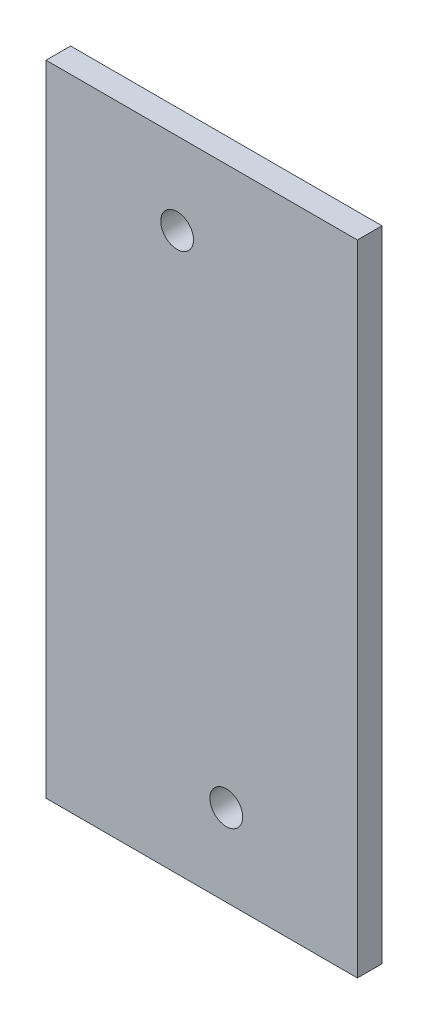
from build123d import *

# Parameters (mm, degrees)
ESQUISSE1_W             = 38
ESQUISSE1_H             = 320
BOSS_EXTRU_1_DEPTH      = 3
ENL_V_MAT_EXTRU_1_REACH = 192.418
ESQUISSE2_R             = 2
ENL_V_MAT_EXTRU_2_REACH = 192.418
ESQUISSE3_W             = 38
ESQUISSE3_H             = 242


with BuildPart() as part:
    # Esquisse1 → Boss.-Extru.1 (new body)
    with BuildSketch(Plane.XY):
        with Locations((76, 5)):
            Rectangle(ESQUISSE1_W, ESQUISSE1_H)
    extrude(amount=BOSS_EXTRU_1_DEPTH)

    # Esquisse2 → Enlèv. mat.-Extru.1 (cut, up to next)
    with BuildSketch(Plane.XY.offset(3), mode=Mode.PRIVATE) as enl_v_mat_extru_1_sk1:
        with Locations((73, 155)):
            Circle(ESQUISSE2_R)
    enl_v_mat_extru_1_tool1 = extrude(enl_v_mat_extru_1_sk1.sketch, amount=-ENL_V_MAT_EXTRU_1_REACH, mode=Mode.PRIVATE) & part.part
    # Esquisse2 → Enlèv. mat.-Extru.1 (cut, up to next)
    with BuildSketch(Plane.XY.offset(3), mode=Mode.PRIVATE) as enl_v_mat_extru_1_sk2:
        with Locations((79, 97)):
            Circle(ESQUISSE2_R)
    enl_v_mat_extru_1_tool2 = extrude(enl_v_mat_extru_1_sk2.sketch, amount=-ENL_V_MAT_EXTRU_1_REACH, mode=Mode.PRIVATE) & part.part
    add(enl_v_mat_extru_1_tool1.solids().sort_by_distance((73, 155, 3))[0], mode=Mode.SUBTRACT)
    add(enl_v_mat_extru_1_tool2.solids().sort_by_distance((79, 97, 3))[0], mode=Mode.SUBTRACT)

    # Esquisse3 → Enlèv. mat.-Extru.2 (cut, up to next)
    with BuildSketch(Plane.XY.offset(3), mode=Mode.PRIVATE) as enl_v_mat_extru_2_sk1:
        with Locations((76, -34)):
            Rectangle(ESQUISSE3_W, ESQUISSE3_H)
    enl_v_mat_extru_2_tool1 = extrude(enl_v_mat_extru_2_sk1.sketch, amount=-ENL_V_MAT_EXTRU_2_REACH, mode=Mode.PRIVATE) & part.part
    add(enl_v_mat_extru_2_tool1.solids().sort_by_distance((76, -34, 3))[0], mode=Mode.SUBTRACT)


solid = part.part
